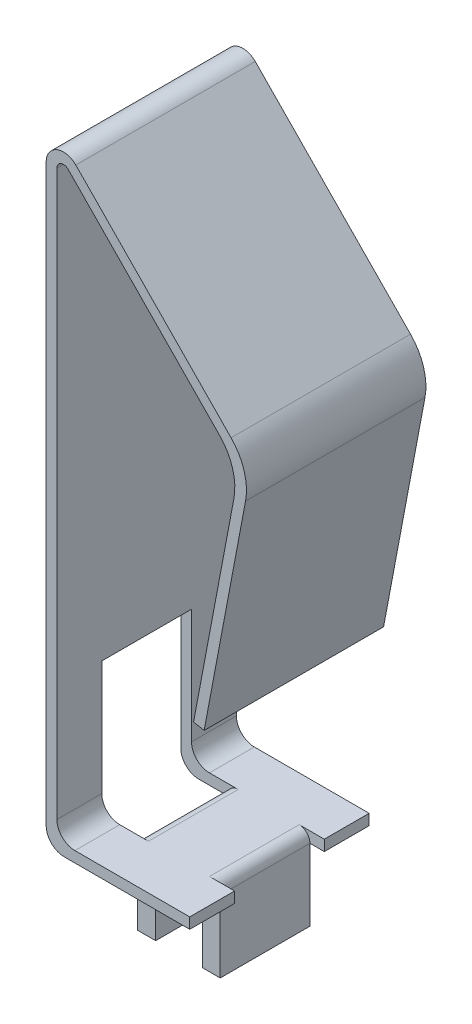
from build123d import *

# Parameters (mm, degrees)
BOSS_EXTRU_1_DEPTH      = 5
CONG_2_R                = 1.5
CONG_3_R                = 0.5
ESQUISSE3_W             = 2.5
ESQUISSE3_H             = 4
ENL_V_MAT_EXTRU_1_DEPTH = 1.3
ESQUISSE4_W             = 2.5
ESQUISSE4_H             = 0.3
ENL_V_MAT_EXTRU_2_DEPTH = 0.4
ESQUISSE5_W             = 2.5
ESQUISSE5_H             = 2
BOSS_EXTRU_2_DEPTH      = 0.5
CONG_4_R                = 0.3


with BuildPart() as part:
    # Esquisse2 → Boss.-Extru.1 (new body)
    with BuildSketch(Plane.XY):
        with BuildLine():
            Line((0, 0), (-3.7, 0))
            Line((-3.7, 0), (-3.7, 16.217812561))
            ThreePointArc((-3.7, 16.217812561), (-3.586649408, 16.386494959), (-3.387643104, 16.345280892))
            Line((-3.387643104, 16.345280892), (1.376192195, 11.480497264))
            Line((1.376192195, 11.480497264), (0.107236318, 4.755627118))
            Line((0.107236318, 4.755627118), (0.402033916, 4.7))
            Line((0.402033916, 4.7), (1.7, 11.578610619))
            Line((1.7, 11.578610619), (-3.173298816, 16.555177357))
            ThreePointArc((-3.173298816, 16.555177357), (-3.7, 16.664256805), (-4, 16.217812561))
            Line((-4, 16.217812561), (-4, -0.3))
            Line((-4, -0.3), (0, -0.3))
            Line((0, -0.3), (0, 0))
        make_face()
    extrude(amount=BOSS_EXTRU_1_DEPTH)

    # Congé2
    cong_2_edges = [part.edges().sort_by_distance(p)[0] for p in [
        (1.376192195, 11.480497264, 2.5),
        (1.7, 11.578610619, 2.5),
    ]]
    fillet(cong_2_edges, radius=CONG_2_R)

    # Congé3
    cong_3_edges = [part.edges().sort_by_distance(p)[0] for p in [
        (-3.7, 0, 2.5),
        (-4, -0.3, 2.5),
    ]]
    fillet(cong_3_edges, radius=CONG_3_R)

    # Esquisse3 → Enlèv. mat.-Extru.1 (cut)
    with BuildSketch(Plane.ZY.offset(4)):
        with Locations((2.5, 1.7)):
            Rectangle(ESQUISSE3_W, ESQUISSE3_H)
    extrude(amount=-ENL_V_MAT_EXTRU_1_DEPTH, mode=Mode.SUBTRACT)

    # Esquisse4 → Enlèv. mat.-Extru.2 (cut)
    with BuildSketch(Plane(origin=(0, 0, 0), x_dir=(0, 0, -1), z_dir=(1, 0, 0))):
        with Locations((-2.5, -0.15)):
            Rectangle(ESQUISSE4_W, ESQUISSE4_H)
    extrude(amount=-ENL_V_MAT_EXTRU_2_DEPTH, mode=Mode.SUBTRACT)

    # Esquisse5 → Boss.-Extru.2 (add)
    with BuildSketch(Plane(origin=(-0.4, 0, 0), x_dir=(0, 0, -1), z_dir=(1, 0, 0))):
        with Locations((-2.5, -1.3)):
            Rectangle(ESQUISSE5_W, ESQUISSE5_H)
    boss_extru_2 = extrude(amount=-BOSS_EXTRU_2_DEPTH)

    # Symétrie1: Boss.-Extru.2 across plane
    add(boss_extru_2.mirror(Plane(origin=(-1.55, 0, 0), x_dir=(0, 0, 1), z_dir=(1, 0, 0))))

    # Congé4
    cong_4_edges = [part.edges().sort_by_distance(p)[0] for p in [
        (-0.4, 0, 2.5),
        (-2.7, 0, 2.5),
        (-0.9, -0.3, 2.5),
        (-2.2, -0.3, 2.5),
    ]]
    fillet(cong_4_edges, radius=CONG_4_R)


solid = part.part
